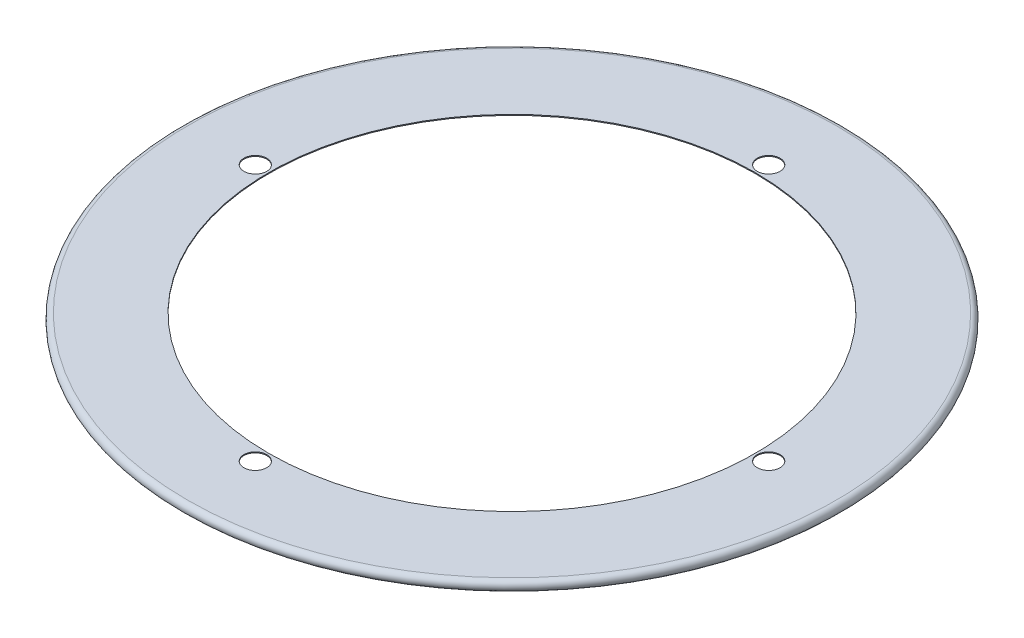
from build123d import *

# Parameters (mm, degrees)
SKETCH3_R          = 5.360033356
CUT_EXTRUDE1_DEPTH = 0.4318


with BuildPart() as part:
    # Sketch2 → Revolve1 (revolve)
    with BuildSketch(Plane.XY, mode=Mode.PRIVATE) as revolve1_sk:
        with BuildLine():
            Line((0, 2.4638), (38.1, 2.4638))
            Line((38.1, 2.4638), (38.1, 2.032))
            Line((38.1, 2.032), (0, 2.032))
            ThreePointArc((0, 2.032), (-2.032, 0), (0, -2.032))
            Line((0, -2.032), (14.902441519, -2.032))
            Line((14.902441519, -2.032), (14.902441519, -2.4638))
            Line((14.902441519, -2.4638), (0, -2.4638))
            ThreePointArc((0, -2.4638), (-2.4638, 0), (0, 2.4638))
        make_face()
    revolve(revolve1_sk.sketch.rotate(Axis((152.4, 15.515798555, 0), (0, -1, 0)), 270), axis=Axis((152.4, 15.515798555, 0), (0, -1, 0)))

    # Sketch3 → Cut-Extrude1 (cut)
    with BuildSketch(Plane(origin=(0, 2.4638, 0), x_dir=(1, 0, 0), z_dir=(0, 1, 0))):
        with Locations(Location((31.78326852, 0, 0), (0, 0, 270))):
            Circle(SKETCH3_R)
        with Locations(Location((152.4, 120.61673148, 0), (0, 0, 270))):
            Circle(SKETCH3_R)
        with Locations(Location((273.01673148, 0, 0), (0, 0, 270))):
            Circle(SKETCH3_R)
        with Locations(Location((152.4, -120.61673148, 0), (0, 0, 270))):
            Circle(SKETCH3_R)
    extrude(amount=-CUT_EXTRUDE1_DEPTH, mode=Mode.SUBTRACT)


solid = part.part
